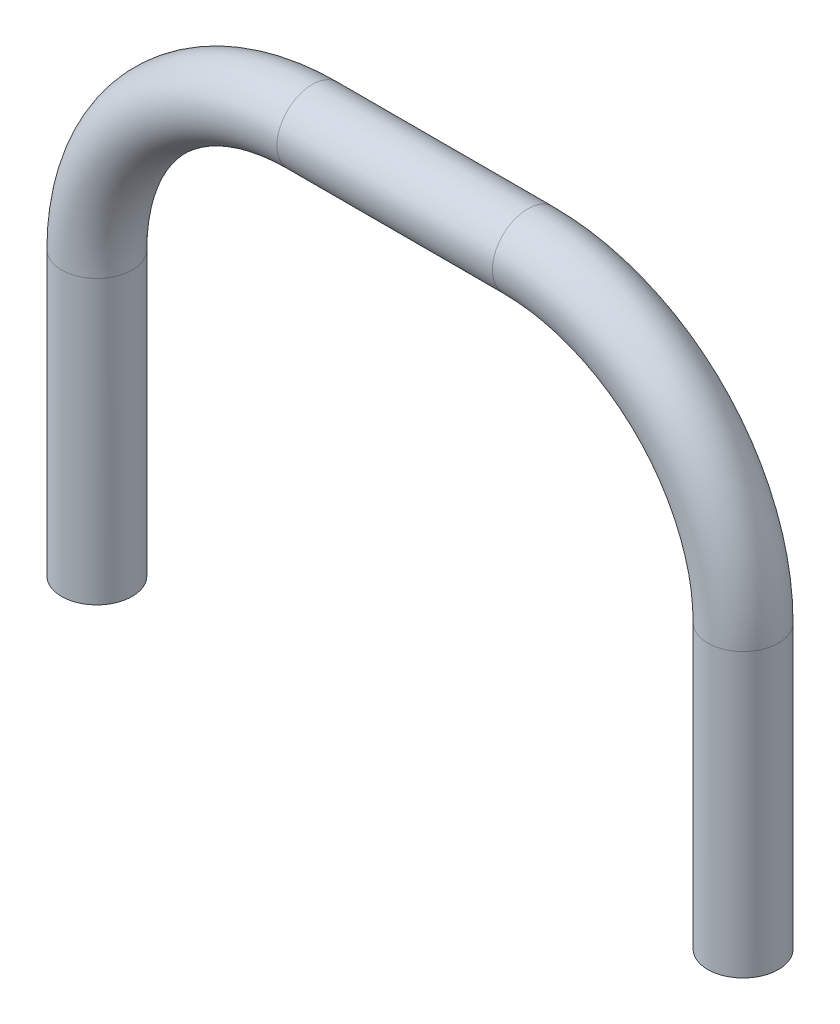
from build123d import *

# Parameters (mm, degrees)
SKETCH2_R          = 33.3375
SKETCH3_R          = 23.8125
CUT_EXTRUDE1_DEPTH = 256.54
SKETCH4_R          = 23.8125
CUT_EXTRUDE2_DEPTH = 261.62


with BuildPart() as part:
    # Sweep1: sweep along a path in Sketch1
    with BuildLine(Plane.XY) as sweep1_path:
        Line((0, 0), (0, 266.7))
        ThreePointArc((0, 266.7), (59.515902063, 410.384097937), (203.2, 469.9))
        Line((203.2, 469.9), (406.4, 469.9))
        ThreePointArc((406.4, 469.9), (550.084097937, 410.384097937), (609.6, 266.7))
        Line((609.6, 266.7), (609.6, 0))
    # Sketch2 → Sweep1 (sweep)
    with BuildSketch(Plane(origin=(0, 0, 0), x_dir=(1, 0, 0), z_dir=(0, 1, 0))):
        Circle(SKETCH2_R)
    sweep(path=sweep1_path.line)

    # Sketch3 → Cut-Extrude1 (cut)
    with BuildSketch(Plane.XZ):
        with Locations(Location((0, 0, 0), (0, 0, 270))):
            Circle(SKETCH3_R)
    extrude(amount=-CUT_EXTRUDE1_DEPTH, mode=Mode.SUBTRACT)

    # Sketch4 → Cut-Extrude2 (cut)
    with BuildSketch(Plane.XZ):
        with Locations((609.6, 0)):
            Circle(SKETCH4_R)
    extrude(amount=-CUT_EXTRUDE2_DEPTH, mode=Mode.SUBTRACT)


solid = part.part
